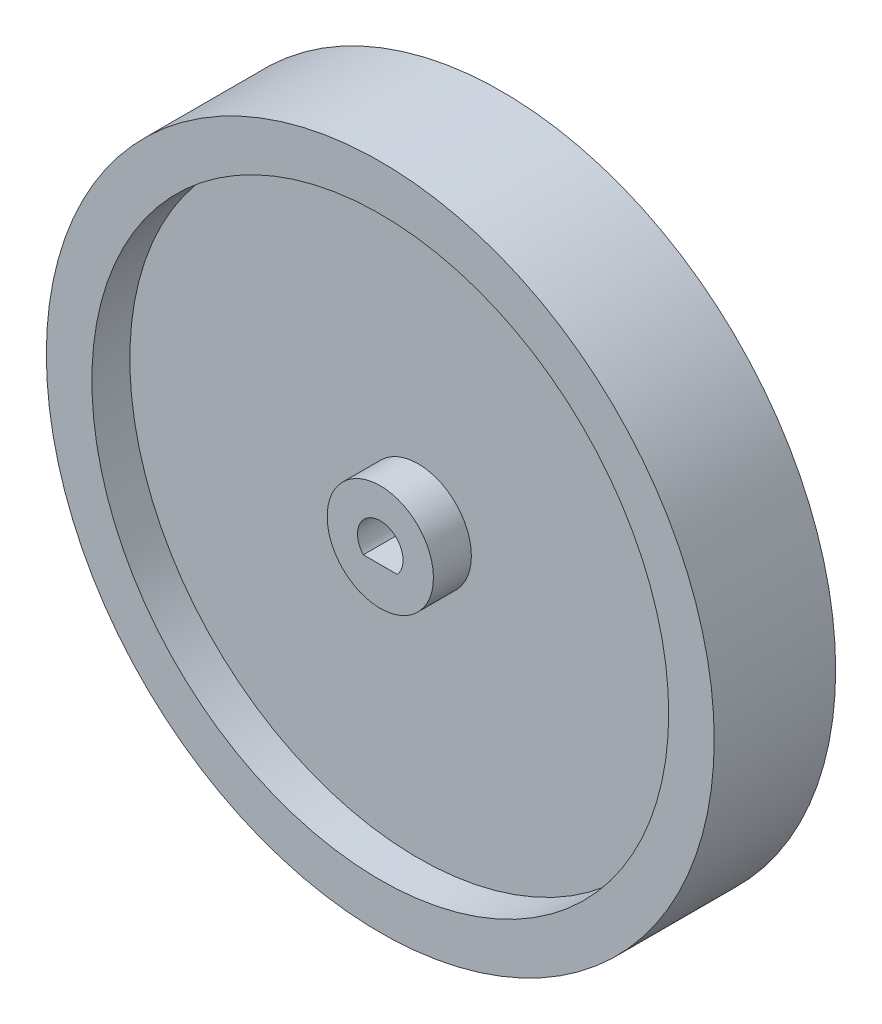
from build123d import *

# Parameters (mm, degrees)
BOSS_EXTRUDE1_DEPTH        = 4
BOSS_EXTRUDE1_DEPTH_BACK   = 4
SKETCH1_R                  = 22
SKETCH1_R_2                = 19
BOSS_EXTRUDE1_2_DEPTH      = 4
BOSS_EXTRUDE1_2_DEPTH_BACK = 4
SKETCH1_R_3                = 3.5
BOSS_EXTRUDE2_DEPTH        = 1.5
BOSS_EXTRUDE2_DEPTH_BACK   = 1.5
SKETCH1_3_R                = 19
SKETCH1_3_R_2              = 3.5


with BuildPart() as part:
    # Sketch1 → Boss-Extrude1 (new, two sides: drawn at the far end of the back side and taken through both)
    with BuildSketch(Plane.XY.offset(-BOSS_EXTRUDE1_DEPTH_BACK)):
        Circle(SKETCH1_R)
        Circle(SKETCH1_R_2, mode=Mode.SUBTRACT)
    extrude(amount=BOSS_EXTRUDE1_DEPTH + BOSS_EXTRUDE1_DEPTH_BACK)



with BuildPart() as body_2:
    # Sketch1 → Boss-Extrude1 2 (new, two sides: drawn at the far end of the back side and taken through both)
    with BuildSketch(Plane.XY.offset(-BOSS_EXTRUDE1_2_DEPTH_BACK)):
        Circle(SKETCH1_R_3)
        with BuildLine():
            Line((1.118033989, -1), (-1.118033989, -1))
            ThreePointArc((-1.118033989, -1), (0, 1.5), (1.118033989, -1))
        make_face(mode=Mode.SUBTRACT)
    extrude(amount=BOSS_EXTRUDE1_2_DEPTH + BOSS_EXTRUDE1_2_DEPTH_BACK)


with BuildPart() as part_1:
    add(part.part)

    add(body_2.part)  # Boss-Extrude2 merges body 2
    # Sketch1<3> → Boss-Extrude2 (add, two sides: drawn at the far end of the back side and taken through both)
    with BuildSketch(Plane.XY.offset(-BOSS_EXTRUDE2_DEPTH_BACK)):
        Circle(SKETCH1_3_R)
        Circle(SKETCH1_3_R_2, mode=Mode.SUBTRACT)
    extrude(amount=BOSS_EXTRUDE2_DEPTH + BOSS_EXTRUDE2_DEPTH_BACK)


solid = part_1.part
